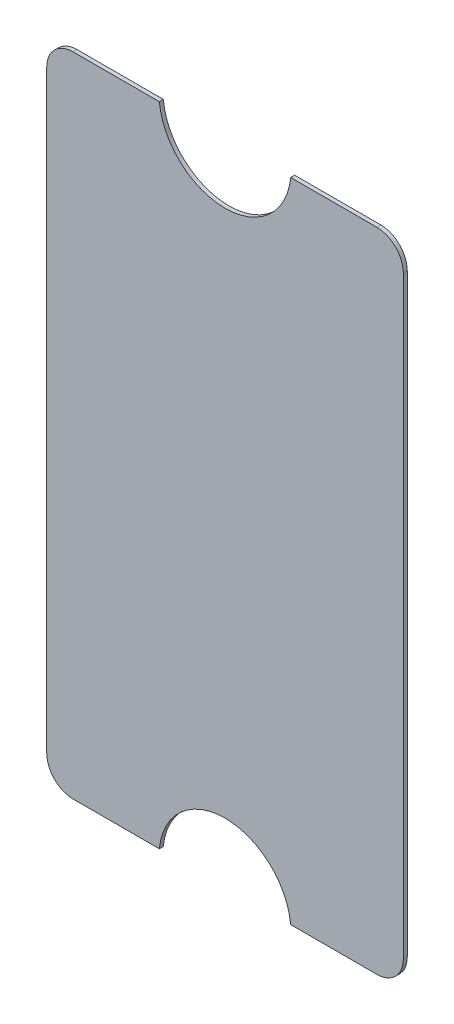
from build123d import *

# Parameters (mm, degrees)
EXTRUDE_1_DEPTH = 0.3


with BuildPart() as part:
    # Эскиз1 → Бобышка-Вытянуть1 (new body)
    with BuildSketch(Plane(origin=(0, 0, 0), x_dir=(-1, 0, 0), z_dir=(0, 0, 1))):
        with BuildLine():
            Line((-4.373858381, -0.5), (-10.898921195, -0.5))
            ThreePointArc((-10.898921195, -0.5), (-12.313134757, -1.085786438), (-12.898921195, -2.5))
            Line((-12.898921195, -2.5), (-12.898921195, -47.5))
            ThreePointArc((-12.898921195, -47.5), (-12.313134757, -48.914213562), (-10.898921195, -49.5))
            Line((-10.898921195, -49.5), (-4.373858381, -49.5))
            ThreePointArc((-4.373858381, -49.5), (0.601078805, -45), (5.57601599, -49.5))
            Line((5.57601599, -49.5), (12.101078805, -49.5))
            ThreePointArc((12.101078805, -49.5), (13.515292367, -48.914213562), (14.101078805, -47.5))
            Line((14.101078805, -47.5), (14.101078805, -2.5))
            ThreePointArc((14.101078805, -2.5), (13.515292367, -1.085786438), (12.101078805, -0.5))
            Line((12.101078805, -0.5), (5.57601599, -0.5))
            ThreePointArc((5.57601599, -0.5), (0.601078805, -5), (-4.373858381, -0.5))
        make_face()
    extrude(amount=EXTRUDE_1_DEPTH)


solid = part.part
